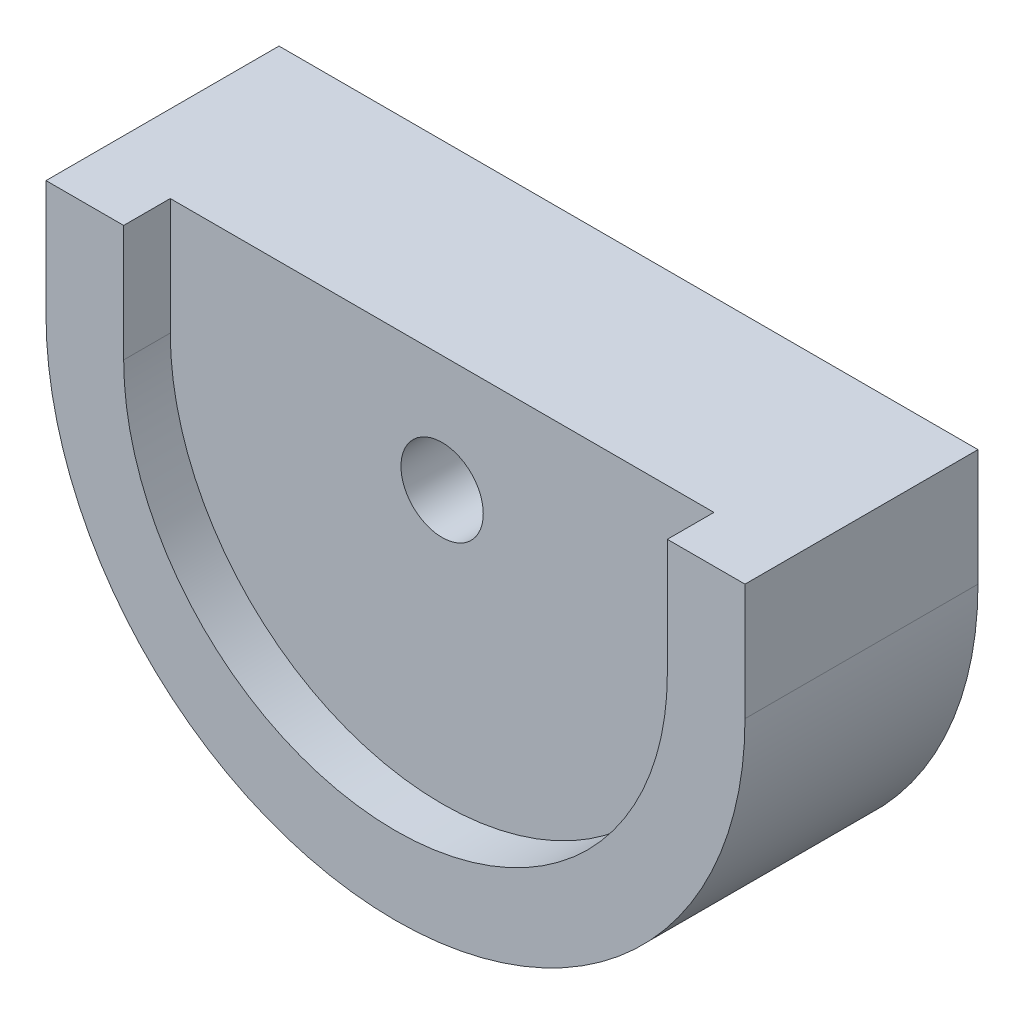
from build123d import *

# Parameters (mm, degrees)
EXTRUDE_1_DEPTH          = 25
CUT_EXTRUDE_1_DEPTH      = 3
CUT_EXTRUDE_2_DEPTH      = 20
CUT_EXTRUDE_2_DEPTH_BACK = 35
SKETCH_3_W               = 45
SKETCH_3_H               = 15
SKETCH_4_R               = 2.65
CUT_EXTRUDE_3_DEPTH      = 35
SKETCH_5_R               = 4.75
CUT_EXTRUDE_4_DEPTH      = 15
SKETCH_6_R               = 24.891831438
CUT_EXTRUDE_5_DEPTH      = 10


with BuildPart() as part:
    # 草图1 → 凸台-拉伸1 (new body)
    with BuildSketch(Plane.XY):
        with BuildLine():
            Line((-22.5, 0), (-22.5, 22.5))
            Line((-22.5, 22.5), (22.5, 22.5))
            Line((22.5, 22.5), (22.5, 0))
            ThreePointArc((22.5, 0), (0, -22.5), (-22.5, 0))
        make_face()
    extrude(amount=EXTRUDE_1_DEPTH)

    # 草图2 → 切除-拉伸1 (cut)
    with BuildSketch(Plane.XY.offset(25)):
        with BuildLine():
            Line((17.5, 22.5), (-17.5, 22.5))
            Line((-17.5, 22.5), (-17.5, 0))
            ThreePointArc((-17.5, 0), (0, 17.5), (17.5, 0))
            Line((17.5, 0), (17.5, 22.5))
        make_face()
        with BuildLine():
            ThreePointArc((17.5, 0), (0, 17.5), (-17.5, 0))
            Line((-17.5, 0), (17.5, 0))
        make_face()
        with BuildLine():
            Line((17.5, 0), (-17.5, 0))
            ThreePointArc((-17.5, 0), (0, -17.5), (17.5, 0))
        make_face()
    extrude(amount=-CUT_EXTRUDE_1_DEPTH, mode=Mode.SUBTRACT)

    # 草图3 → 切除-拉伸2 (cut, two sides: drawn at the far end of the back side and taken through both)
    with BuildSketch(Plane.XY.offset(22).offset(-CUT_EXTRUDE_2_DEPTH_BACK)):
        with Locations((0, 15)):
            Rectangle(SKETCH_3_W, SKETCH_3_H)
    extrude(amount=CUT_EXTRUDE_2_DEPTH + CUT_EXTRUDE_2_DEPTH_BACK, mode=Mode.SUBTRACT)

    # 草图4 → 切除-拉伸3 (cut)
    with BuildSketch(Plane.XY.offset(22)):
        Circle(SKETCH_4_R)
    extrude(amount=-CUT_EXTRUDE_3_DEPTH, mode=Mode.SUBTRACT)

    # 草图5 → 切除-拉伸4 (cut)
    with BuildSketch(Plane(origin=(0, 0, 0), x_dir=(-1, 0, 0), z_dir=(0, 0, -1))):
        Circle(SKETCH_5_R)
    extrude(amount=-CUT_EXTRUDE_4_DEPTH, mode=Mode.SUBTRACT)

    # 草图6 → 切除-拉伸5 (cut)
    with BuildSketch(Plane(origin=(0, 0, 0), x_dir=(-1, 0, 0), z_dir=(0, 0, -1))):
        Circle(SKETCH_6_R)
    extrude(amount=-CUT_EXTRUDE_5_DEPTH, mode=Mode.SUBTRACT)


solid = part.part
